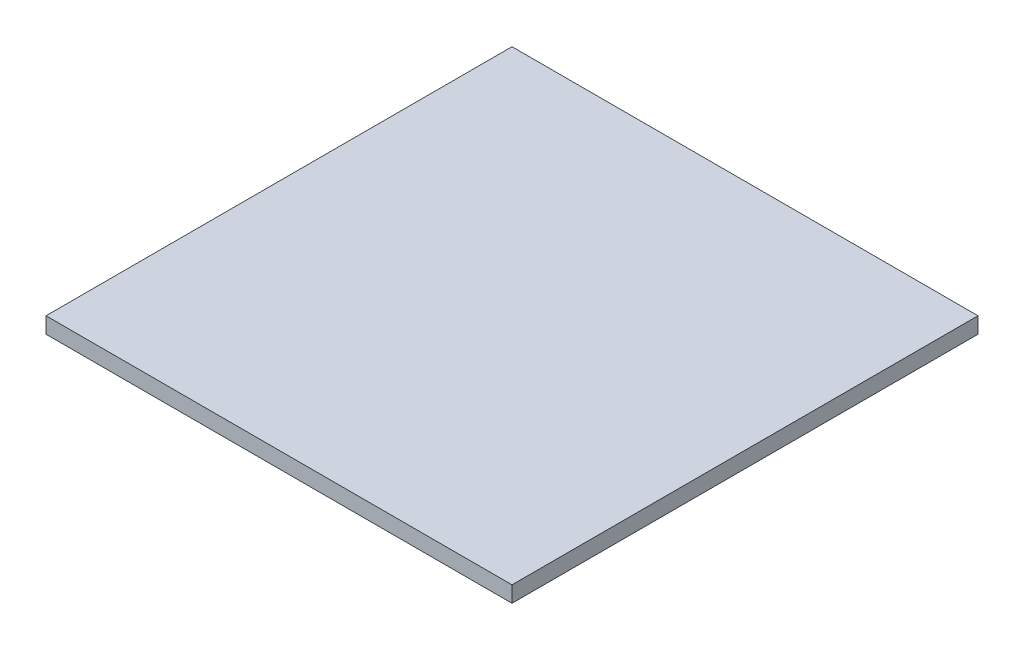
from build123d import *

# Parameters (mm, degrees)
SKETCH1_W           = 508
SKETCH1_H           = 508
SKETCH1_R           = 31.75
BOSS_EXTRUDE1_DEPTH = 17.4625


with BuildPart() as part:
    # Sketch1 → Boss-Extrude1 (new body)
    # profile 1 of 3: a face of its own
    with BuildSketch(Plane(origin=(0, 0, 0), x_dir=(1, 0, 0), z_dir=(0, 1, 0))):
        Rectangle(SKETCH1_W, SKETCH1_H)
        with Locations((88.9, -153.9875)):
            Circle(SKETCH1_R, mode=Mode.SUBTRACT)
        with Locations((-88.9, -153.9875)):
            Circle(SKETCH1_R, mode=Mode.SUBTRACT)
    # profile 2 of 3: a face of its own
    with BuildSketch(Plane(origin=(0, 0, 0), x_dir=(1, 0, 0), z_dir=(0, 1, 0))):
        with Locations((88.9, -153.9875)):
            Circle(SKETCH1_R)
    # profile 3 of 3: a face of its own
    with BuildSketch(Plane(origin=(0, 0, 0), x_dir=(1, 0, 0), z_dir=(0, 1, 0))):
        with Locations((-88.9, -153.9875)):
            Circle(SKETCH1_R)
    extrude(amount=BOSS_EXTRUDE1_DEPTH)


solid = part.part
